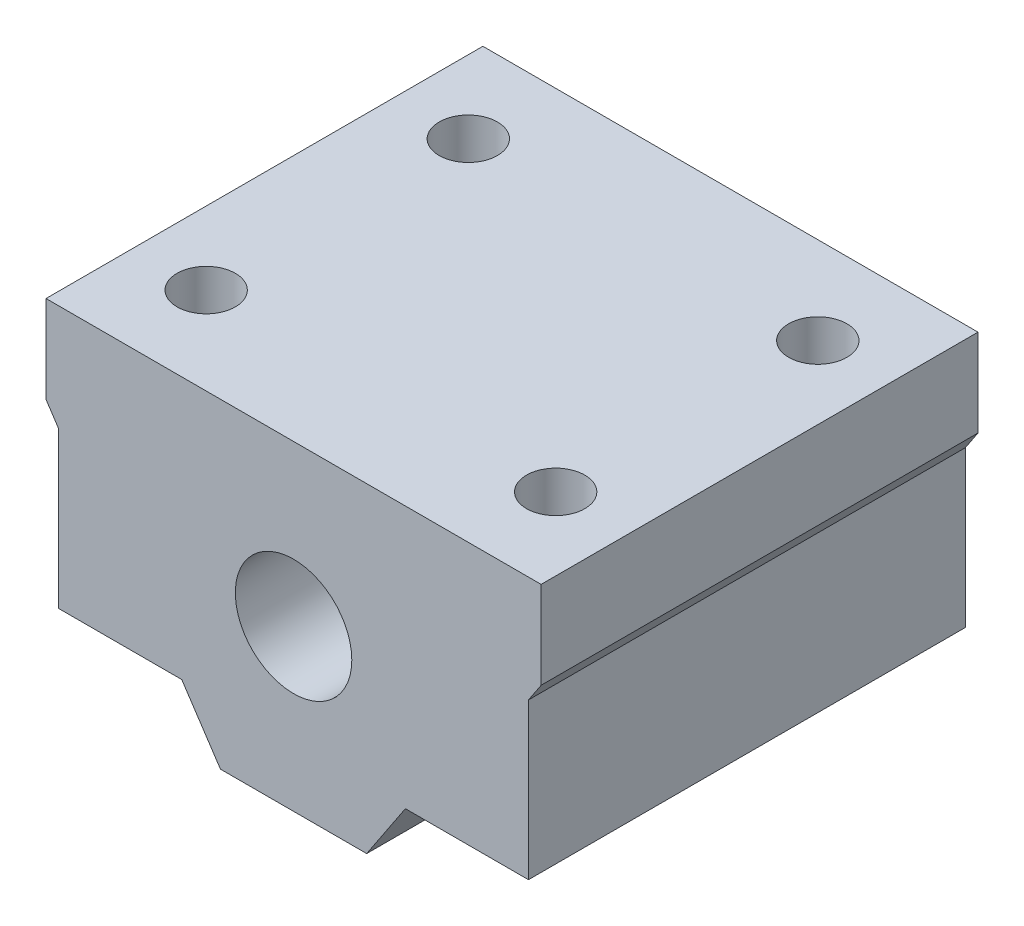
from build123d import *

# Parameters (mm, degrees)
SKETCH_1_R               = 4
EXTRUDE_1_DEPTH          = 30
SKETCH_2_R               = 2
CUT_EXTRUDE_1_DEPTH      = 8
CUT_EXTRUDE_2_DEPTH      = 41.902322672
CUT_EXTRUDE_2_DEPTH_BACK = 41.902322672
SKETCH_4_R               = 1.7


with BuildPart() as part:
    # 草图1 → 凸台-拉伸1 (new body)
    with BuildSketch(Plane.XY):
        Polygon((17, 11), (-17, 11), (-17, 5), (-16.130865539, 3.691288487), (-16.130865539, -7), (-7.678245569, -7), (-5.021787053, -11), (5.021787053, -11), (7.678245569, -7), (16.130865539, -7), (16.130865539, 3.691288487), (17, 5), align=None)
        Circle(SKETCH_1_R, mode=Mode.SUBTRACT)
    extrude(amount=EXTRUDE_1_DEPTH)

    # 草图2 → 切除-拉伸1 (cut)
    with BuildSketch(Plane(origin=(0, 11, 0), x_dir=(1, 0, 0), z_dir=(0, 1, 0))):
        with Locations(Location((-12, -6, 0), (0, 0, 270))):
            Circle(SKETCH_2_R)
        with Locations(Location((-12, -24, 0), (0, 0, 270))):
            Circle(SKETCH_2_R)
        with Locations(Location((12, -6, 0), (0, 0, 270))):
            Circle(SKETCH_2_R)
        with Locations(Location((12, -24, 0), (0, 0, 270))):
            Circle(SKETCH_2_R)
    extrude(amount=-CUT_EXTRUDE_1_DEPTH, mode=Mode.SUBTRACT)

    # 草图4 → 切除-拉伸2 (cut, two sides: drawn at the far end of the back side and taken through both)
    with BuildSketch(Plane(origin=(0, 11, 0), x_dir=(1, 0, 0), z_dir=(0, 1, 0)).offset(-CUT_EXTRUDE_2_DEPTH_BACK)):
        with Locations(Location((-12, -6, 0), (0, 0, 270))):
            Circle(SKETCH_4_R)
        with Locations(Location((-12, -24, 0), (0, 0, 270))):
            Circle(SKETCH_4_R)
        with Locations(Location((12, -6, 0), (0, 0, 270))):
            Circle(SKETCH_4_R)
        with Locations(Location((12, -24, 0), (0, 0, 270))):
            Circle(SKETCH_4_R)
    extrude(amount=CUT_EXTRUDE_2_DEPTH + CUT_EXTRUDE_2_DEPTH_BACK, mode=Mode.SUBTRACT)


solid = part.part
